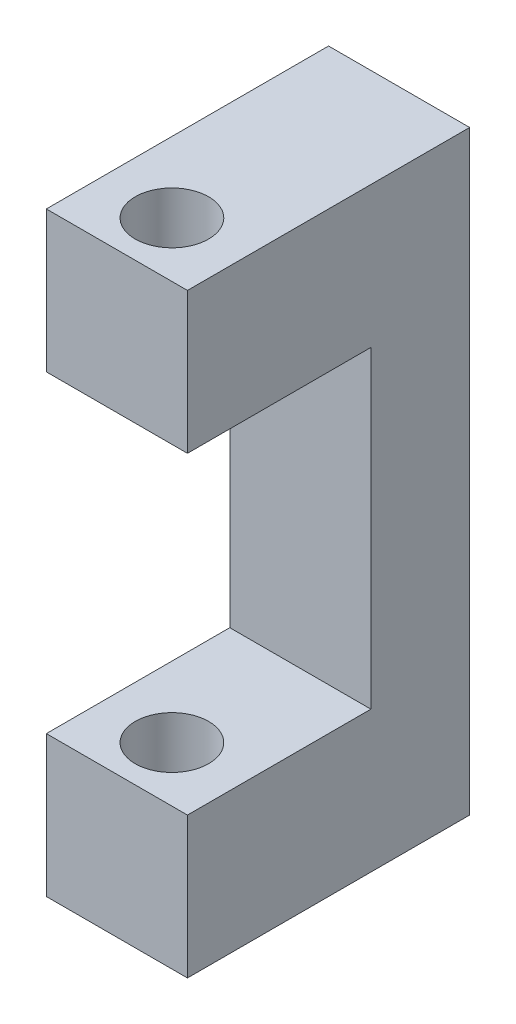
from build123d import *

# Parameters (mm, degrees)
SKETCH1_W           = 34.2
SKETCH1_H           = 10
SKETCH1_R           = 2.1
BOSS_EXTRUDE1_DEPTH = 3
SKETCH2_W           = 10
SKETCH2_H           = 6
SKETCH2_R           = 2.1
BOSS_EXTRUDE2_DEPTH = 3
SKETCH4_W           = 10
SKETCH4_H           = 6
BOSS_EXTRUDE3_DEPTH = 12
SKETCH5_R           = 2.6
CUT_EXTRUDE1_DEPTH  = 45
SKETCH6_W           = 10
SKETCH6_H           = 22.2
BOSS_EXTRUDE4_DEPTH = 2
BOSS_EXTRUDE5_START = 4
SKETCH7_W           = 10
SKETCH7_H           = 18
SKETCH7_R           = 2.6
BOSS_EXTRUDE5_DEPTH = 4
SKETCH8_W           = 10
SKETCH8_H           = 18
SKETCH8_R           = 2.6
BOSS_EXTRUDE6_DEPTH = 4
BOSS_EXTRUDE7_START = 2
SKETCH10_W          = 10
SKETCH10_H          = 42.2
SKETCH10_R          = 2.1
BOSS_EXTRUDE7_DEPTH = 2


with BuildPart() as part:
    # Sketch1 → Boss-Extrude1 (new body)
    with BuildSketch(Plane(origin=(0, 0, 0), x_dir=(0, 1, 0), z_dir=(0, 0, 1))):
        with Locations((-58.633609256, 5)):
            Rectangle(SKETCH1_W, SKETCH1_H)
        with Locations(Location((-72.733609256, 5, 0), (0, 0, 90))):
            Circle(SKETCH1_R, mode=Mode.SUBTRACT)
        with Locations(Location((-44.533609256, 5, 0), (0, 0, 90))):
            Circle(SKETCH1_R, mode=Mode.SUBTRACT)
    extrude(amount=BOSS_EXTRUDE1_DEPTH)

    # Sketch2 → Boss-Extrude2 (add)
    # profile 1 of 2: a face of its own
    with BuildSketch(Plane.XY.offset(3)):
        with Locations((-5, -44.533609256)):
            Rectangle(SKETCH2_W, SKETCH2_H)
        with Locations(Location((-5, -44.533609256, 0), (0, 0, 180))):
            Circle(SKETCH2_R, mode=Mode.SUBTRACT)
    # profile 2 of 2: a face of its own
    with BuildSketch(Plane.XY.offset(3)):
        with Locations((-5, -72.733609256)):
            Rectangle(SKETCH2_W, SKETCH2_H)
        with Locations(Location((-5, -72.733609256, 0), (0, 0, 180))):
            Circle(SKETCH2_R, mode=Mode.SUBTRACT)
    extrude(amount=BOSS_EXTRUDE2_DEPTH)

    # Sketch4 → Boss-Extrude3 (add)
    with BuildSketch(Plane.XY.offset(6)):
        with Locations((-5, -44.533609256)):
            Rectangle(SKETCH4_W, SKETCH4_H)
        with Locations((-5, -72.733609256)):
            Rectangle(SKETCH4_W, SKETCH4_H)
    extrude(amount=BOSS_EXTRUDE3_DEPTH)

    # Sketch5 → Cut-Extrude1 (cut)
    with BuildSketch(Plane.XZ.offset(75.733609256)):
        with Locations(Location((-5, 14.1, 0), (0, 0, 90))):
            Circle(SKETCH5_R)
    extrude(amount=-CUT_EXTRUDE1_DEPTH, mode=Mode.SUBTRACT)

    # Sketch6 → Boss-Extrude4 (add)
    with BuildSketch(Plane.XY.offset(3)):
        with Locations((-5, -58.633609256)):
            Rectangle(SKETCH6_W, SKETCH6_H)
    extrude(amount=BOSS_EXTRUDE4_DEPTH)

    # Sketch7 → Boss-Extrude5 (add)
    with BuildSketch(Plane.XZ.offset(75.733609256).offset(BOSS_EXTRUDE5_START)):
        with Locations((-5, 9)):
            Rectangle(SKETCH7_W, SKETCH7_H)
        with Locations(Location((-5, 14.1, 0), (0, 0, 90))):
            Circle(SKETCH7_R, mode=Mode.SUBTRACT)
    extrude(amount=-BOSS_EXTRUDE5_DEPTH)

    # Sketch8 → Boss-Extrude6 (add)
    with BuildSketch(Plane(origin=(0, -41.533609256, 0), x_dir=(-1, 0, 0), z_dir=(0, 1, 0))):
        with Locations((5, 9)):
            Rectangle(SKETCH8_W, SKETCH8_H)
        with Locations(Location((5, 14.1, 0), (0, 0, 90))):
            Circle(SKETCH8_R, mode=Mode.SUBTRACT)
    extrude(amount=BOSS_EXTRUDE6_DEPTH)

    # Sketch10 → Boss-Extrude7 (add)
    with BuildSketch(Plane(origin=(0, 0, 0), x_dir=(1, 0, 0), z_dir=(0, 0, -1)).offset(BOSS_EXTRUDE7_START)):
        with Locations((-5, 58.633609256)):
            Rectangle(SKETCH10_W, SKETCH10_H)
        with Locations(Location((-5, 72.733609256, 0), (0, 0, 180))):
            Circle(SKETCH10_R, mode=Mode.SUBTRACT)
        with Locations(Location((-5, 44.533609256, 0), (0, 0, 180))):
            Circle(SKETCH10_R, mode=Mode.SUBTRACT)
    extrude(amount=-BOSS_EXTRUDE7_DEPTH)


solid = part.part
